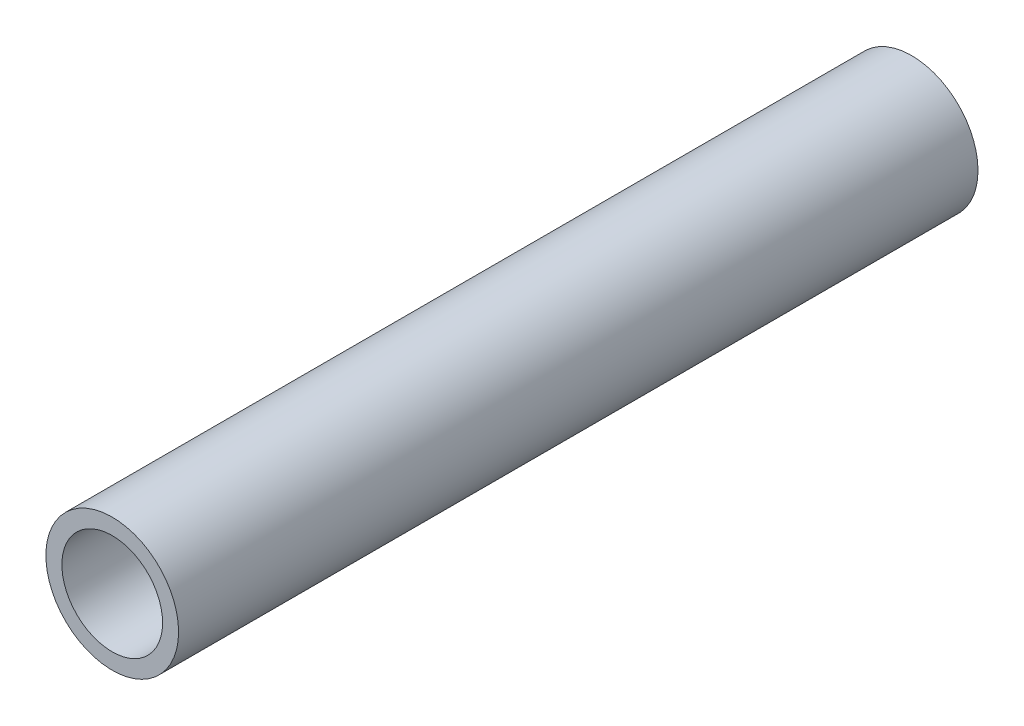
from build123d import *

# Parameters (mm, degrees)
CROQUIS1_R              = 41.5
CROQUIS1_R_2            = 31.5
SALIENTE_EXTRUIR1_DEPTH = 500


with BuildPart() as part:
    # Croquis1 → Saliente-Extruir1 (new body)
    with BuildSketch(Plane.XY):
        Circle(CROQUIS1_R)
        Circle(CROQUIS1_R_2, mode=Mode.SUBTRACT)
    extrude(amount=SALIENTE_EXTRUIR1_DEPTH)


solid = part.part
